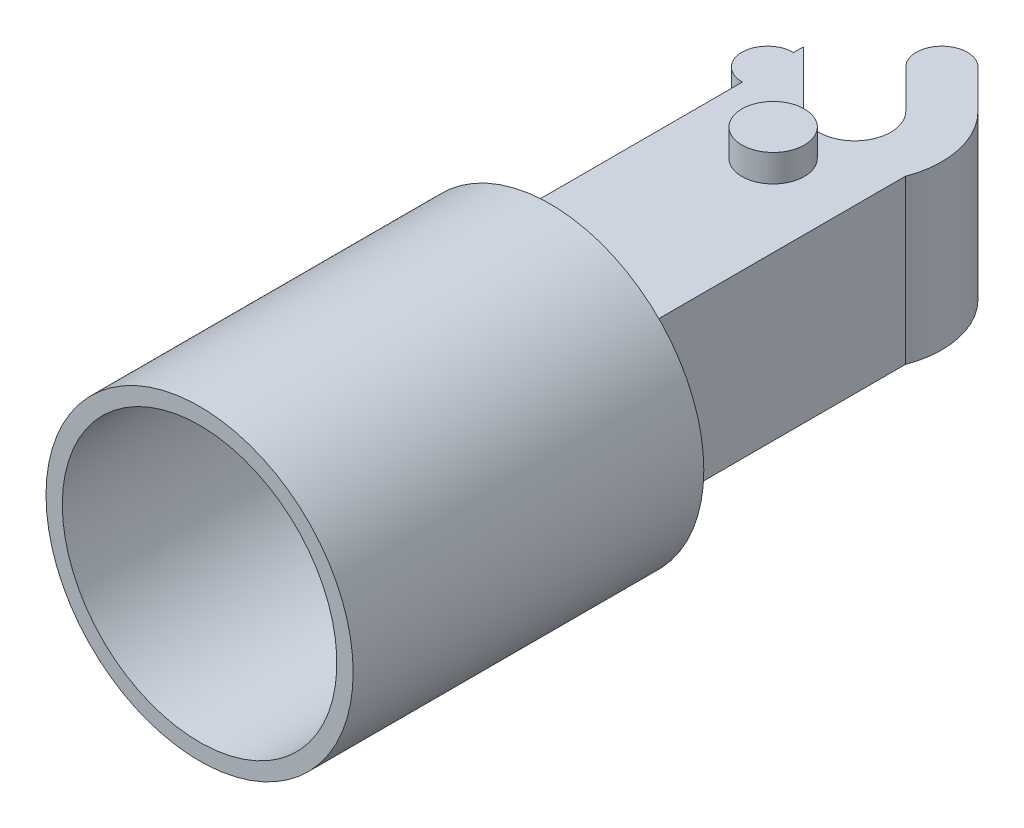
from build123d import *

# Parameters (mm, degrees)
SKETCH1_R           = 2.875
BOSS_EXTRUDE1_DEPTH = 20
SKETCH2_R           = 2.875
BOSS_EXTRUDE2_DEPTH = 14.99
BOSS_EXTRUDE3_DEPTH = 14.99
SKETCH4_R           = 14.125
SKETCH4_W           = 15
SKETCH4_H           = 14.99
SKETCH4_H_2         = 7.495
BOSS_EXTRUDE4_DEPTH = 6.25
SKETCH5_R           = 14.125
SKETCH5_R_2         = 12.625
BOSS_EXTRUDE5_DEPTH = 26
BOSS_EXTRUDE8_DEPTH = 14.99
CUT_EXTRUDE3_DEPTH  = 59.732465681


with BuildPart() as part:
    # Sketch1 → Boss-Extrude1 (new body)
    with BuildSketch(Plane(origin=(0, 0, 0), x_dir=(1, 0, 0), z_dir=(0, 1, 0))):
        with Locations(Location((0, 0, 0), (0, 0, 270))):
            Circle(SKETCH1_R)
    extrude(amount=BOSS_EXTRUDE1_DEPTH)

    # Sketch2 → Boss-Extrude2 (add)
    with BuildSketch(Plane(origin=(0, 2.5, 0), x_dir=(-1, 0, 0), z_dir=(0, -1, 0))):
        with BuildLine():
            Line((-4, 7.5), (-4, 10))
            ThreePointArc((-4, 10), (-5.75, 11.75), (-7.5, 10))
            Line((-7.5, 10), (-7.5, 0))
            ThreePointArc((-7.5, 0), (0, -7.5), (7.5, 0))
            Line((7.5, 0), (7.5, 10))
            ThreePointArc((7.5, 10), (5.75, 11.75), (4, 10))
            Line((4, 10), (4, 7.5))
            ThreePointArc((4, 7.5), (0, 3.5), (-4, 7.5))
        make_face()
        with Locations(Location((0, 0, 0), (0, 0, 90))):
            Circle(SKETCH2_R, mode=Mode.SUBTRACT)
    extrude(amount=-BOSS_EXTRUDE2_DEPTH)

    # Sketch3 → Boss-Extrude3 (add)
    with BuildSketch(Plane(origin=(0, 2.5, 0), x_dir=(-1, 0, 0), z_dir=(0, -1, 0))):
        with BuildLine():
            Line((7.5, 0), (7.5, -20.5))
            Line((7.5, -20.5), (-7.5, -20.5))
            Line((-7.5, -20.5), (-7.5, 0))
            ThreePointArc((-7.5, 0), (0, -7.5), (7.5, 0))
        make_face()
    extrude(amount=-BOSS_EXTRUDE3_DEPTH)

    # Sketch4 → Boss-Extrude4 (add)
    # profile 1 of 3: a face of its own
    with BuildSketch(Plane.XY.offset(20.5)):
        with Locations((0, 9.995)):
            Circle(SKETCH4_R)
        with Locations((0, 9.995)):
            Rectangle(SKETCH4_W, SKETCH4_H, mode=Mode.SUBTRACT)
    # profile 2 of 3: a face of its own
    with BuildSketch(Plane.XY.offset(20.5)):
        with Locations((0, 13.7425)):
            Rectangle(SKETCH4_W, SKETCH4_H_2)
    # profile 3 of 3: a face of its own
    with BuildSketch(Plane.XY.offset(20.5)):
        with Locations((0, 6.2475)):
            Rectangle(SKETCH4_W, SKETCH4_H_2)
    extrude(amount=BOSS_EXTRUDE4_DEPTH)

    # Sketch5 → Boss-Extrude5 (add)
    with BuildSketch(Plane.XY.offset(26.75)):
        with Locations((0, 9.995)):
            Circle(SKETCH5_R)
        with Locations(Location((0, 9.995, 0), (0, 0, 180))):
            Circle(SKETCH5_R_2, mode=Mode.SUBTRACT)
    extrude(amount=BOSS_EXTRUDE5_DEPTH)

    # Sketch6 → Boss-Extrude8 (add)
    with BuildSketch(Plane(origin=(0, 2.5, 0), x_dir=(-1, 0, 0), z_dir=(0, -1, 0))):
        with BuildLine():
            Line((-2.135439924, 16.706507736), (-5.67097383, 13.17097383))
            ThreePointArc((-5.67097383, 13.17097383), (-6.629279887, 12.013594636), (-7.354872555, 10.697770796))
            ThreePointArc((-7.354872555, 10.697770796), (-5.393648327, 11.713334026), (-4, 10))
            Line((-4, 10), (-4, 7.5))
            ThreePointArc((-4, 7.5), (-0.388580969, 3.518919138), (3.924502415, 6.726513871))
            Line((3.924502415, 6.726513871), (2.348994272, 5.151005728))
            ThreePointArc((2.348994272, 5.151005728), (-2.348994272, 5.151005728), (-2.348994272, 9.848994272))
            Line((-2.348994272, 9.848994272), (1.186539634, 13.384528178))
            ThreePointArc((1.186539634, 13.384528178), (1.186539634, 16.706507736), (-2.135439924, 16.706507736))
        make_face()
        with BuildLine():
            ThreePointArc((-7.5, 10), (-7.463334026, 10.356351673), (-7.354872555, 10.697770796))
            ThreePointArc((-7.354872555, 10.697770796), (-8.017652884, 7.692692975), (-7.5, 4.659245108))
            Line((-7.5, 4.659245108), (-7.5, 10))
        make_face()
        with BuildLine():
            Line((7.5, 9.375108987), (7.5, 4.675990723))
            ThreePointArc((7.5, 4.675990723), (9.895517957, 7.025549855), (7.5, 9.375108987))
        make_face()
    extrude(amount=-BOSS_EXTRUDE8_DEPTH)

    # Sketch7 → Cut-Extrude3 (cut, through all)
    with BuildSketch(Plane(origin=(0, 2.5, 0), x_dir=(-1, 0, 0), z_dir=(0, -1, 0))):
        Polygon((3.924502415, 6.726513871), (1.023758885, 9.627257401), (6.777821546, 15.381320062), (9.647679203, 12.449690659), align=None)
    extrude(amount=-CUT_EXTRUDE3_DEPTH, mode=Mode.SUBTRACT)


solid = part.part
